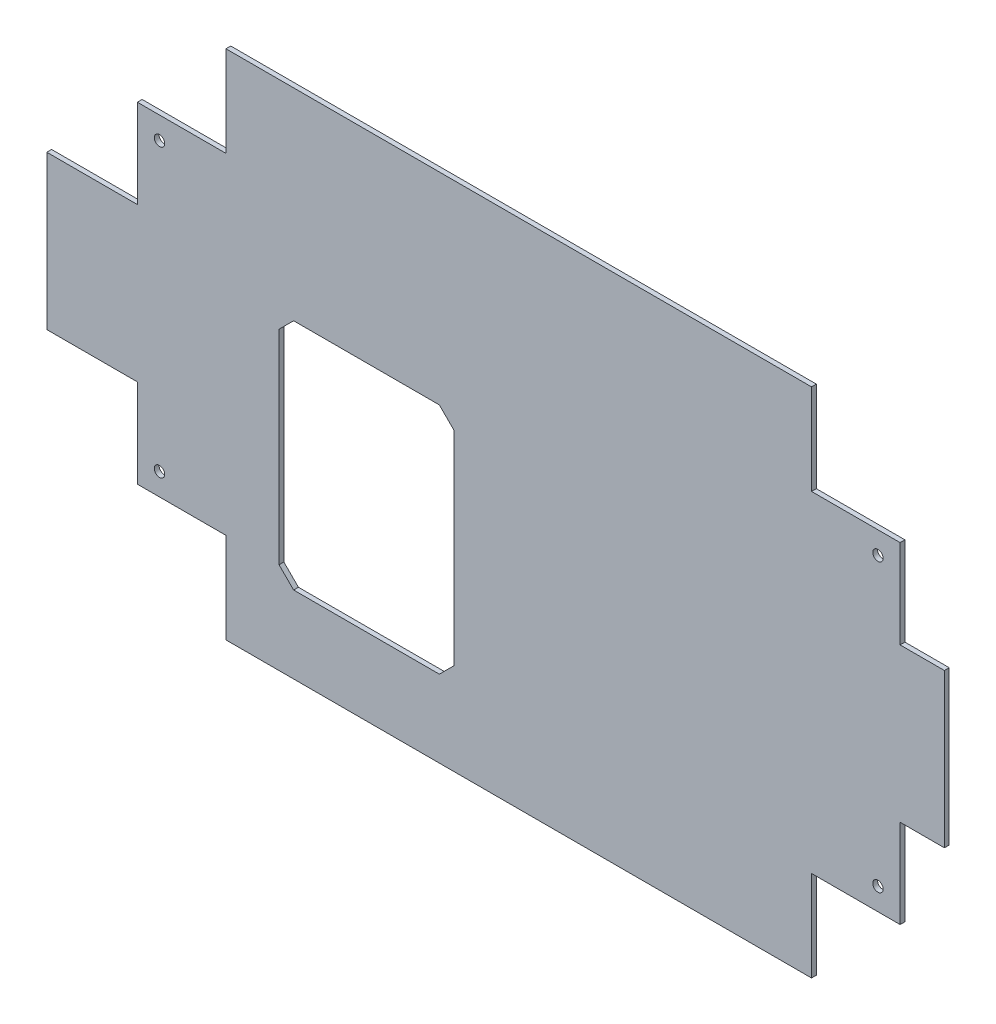
from build123d import *

# Parameters (mm, degrees)
BOSS_EXTRU_1_DEPTH      = 3.3
ESQUISSE2_W             = 401.8
ESQUISSE2_H             = 6.35
ENL_V_MAT_EXTRU_1_DEPTH = 643.284432709
D_GAGEMENT_1_41_D       = 7.14248
ESQUISSE5_W             = 401.8
ESQUISSE5_H             = 1.35
BOSS_EXTRU_2_DEPTH      = 3.3
ESQUISSE6_W             = 120
ESQUISSE6_H             = 160
ENL_V_MAT_EXTRU_2_DEPTH = 641.514024046
CHANFREIN1_SIZE         = 10


with BuildPart() as part:
    # Esquisse1 → Boss.-Extru.1 (new body)
    with BuildSketch(Plane.XY):
        Polygon((-615.95, 52.7), (-615.95, -52.7), (-553.8, -52.7), (-553.8, -113.5), (-493, -113.5), (-493, -174.3), (-91.2, -174.3), (-91.2, -113.5), (-30.4, -113.5), (-30.4, -52.7), (0, -52.7), (0, 52.7), (-30.4, 52.7), (-30.4, 113.5), (-91.2, 113.5), (-91.2, 182), (-493, 182), (-493, 113.5), (-553.8, 113.5), (-553.8, 52.7), align=None)
    extrude(amount=BOSS_EXTRU_1_DEPTH)

    # Esquisse2 → Enlèv. mat.-Extru.1 (cut, through all)
    with BuildSketch(Plane.XY.offset(3.3)):
        with Locations((-292.1, 178.825)):
            Rectangle(ESQUISSE2_W, ESQUISSE2_H)
    extrude(amount=-ENL_V_MAT_EXTRU_1_DEPTH, mode=Mode.SUBTRACT)

    # Dégagement 1/41 (through all)
    with Locations(Plane(origin=(0, 0, 0), x_dir=(-1, 0, 0), z_dir=(0, 0, -1))):
        with Locations((45.6, 98.3), (45.6, -98.3), (538.6, -98.3), (538.6, 98.3)):
            Hole(D_GAGEMENT_1_41_D / 2)

    # Esquisse5 → Boss.-Extru.2 (add, through all)
    with BuildSketch(Plane.XY.offset(3.3)):
        with Locations((-292.1, -174.975)):
            Rectangle(ESQUISSE5_W, ESQUISSE5_H)
    extrude(amount=-BOSS_EXTRU_2_DEPTH)

    # Esquisse6 → Enlèv. mat.-Extru.2 (cut, through all)
    with BuildSketch(Plane(origin=(0, 0, 0), x_dir=(-1, 0, 0), z_dir=(0, 0, -1))):
        with Locations((396.566519887, -42.768394731)):
            Rectangle(ESQUISSE6_W, ESQUISSE6_H)
    extrude(amount=-ENL_V_MAT_EXTRU_2_DEPTH, mode=Mode.SUBTRACT)

    # Chanfrein1
    chanfrein1_edges = [part.edges().sort_by_distance(p)[0] for p in [
        (-336.566519887, -122.768394731, 1.65),
        (-336.566519887, 37.231605269, 1.65),
        (-456.566519887, 37.231605269, 1.65),
        (-456.566519887, -122.768394731, 1.65),
    ]]
    chamfer(chanfrein1_edges, length=CHANFREIN1_SIZE)


solid = part.part
